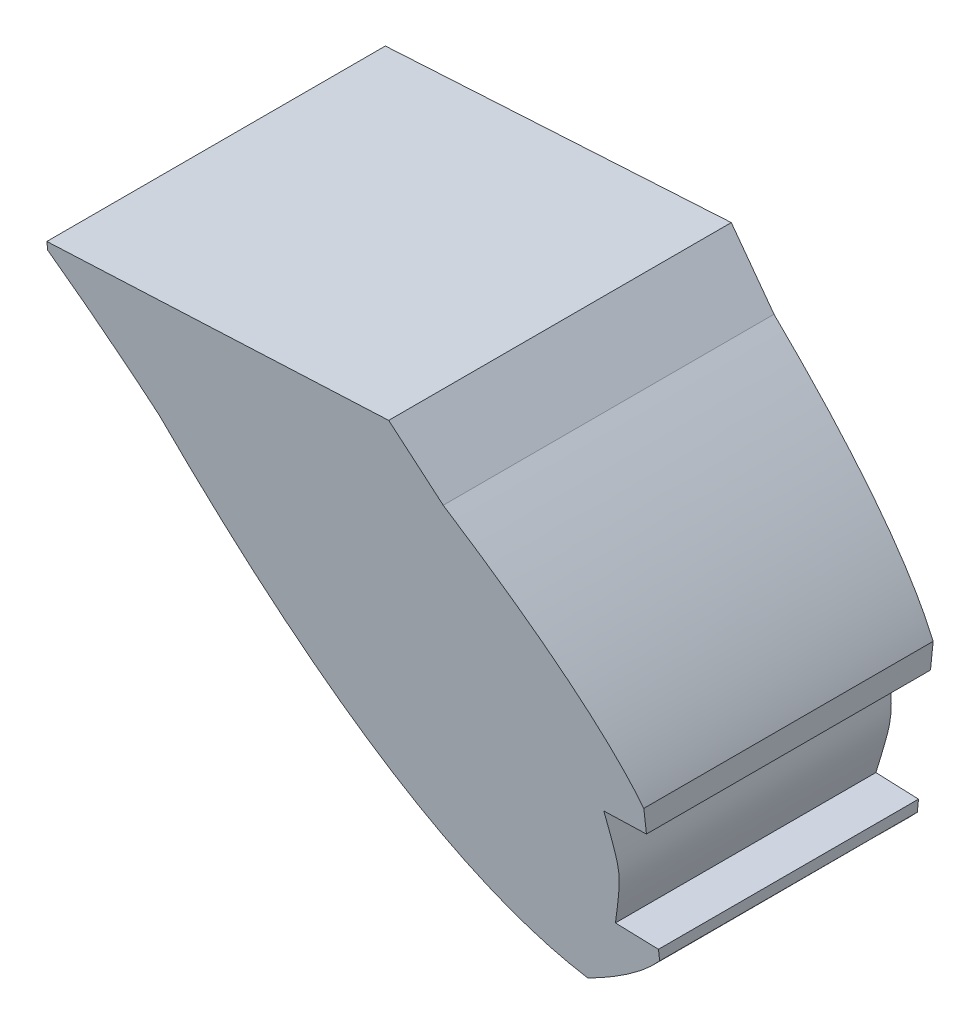
from build123d import *

# Parameters (mm, degrees)
SALIENTE_EXTRUIR1_DEPTH      = 7
SALIENTE_EXTRUIR2_DEPTH      = 7
SALIENTE_EXTRUIR2_DEPTH_BACK = 7
CORTAR_EXTRUIR2_DEPTH        = 28.177550449
CORTAR_EXTRUIR2_DEPTH_BACK   = 28.177550449


with BuildPart() as part:
    # Croquis1 → Saliente-Extruir1 (new, symmetric)
    with BuildSketch(Plane.XY):
        with BuildLine():
            add(Edge.make_bspline(
                [(-18.945192114, 7.540918896), (-10.215008384, -3.697644103), (-2.846604825, -5.059081104)],
                knots=[0.497667241, 0.497667241, 0.497667241, 0.49955428, 0.49955428, 0.49955428], degree=2, weights=[1, 1, 1]))
            add(Edge.make_bspline(
                [(-2.846604825, -5.059081104), (-0.742366882, -3.9352066), (0.355125, -2.723253227)],
                knots=[0.498812075, 0.498812075, 0.498812075, 0.499412845, 0.499412845, 0.499412845], degree=2, weights=[1, 1, 1]))
            Line((0.355125, -2.723253227), (0.355125, -2.284841781))
            Line((0.355125, -2.284841781), (-1.394875, -2.223730435))
            add(Edge.make_bspline(
                [(-1.394875, -2.223730435), (-0.90753067, -0.123730435), (-1.394875, 1.976269565)],
                knots=[0, 0, 0, 1, 1, 1], degree=2, weights=[1, 3.231801219, 1]))
            Line((-1.394875, 1.976269565), (0.355125, 2.284841781))
            Line((0.355125, 2.284841781), (0.355125, 3.001549529))
            add(Edge.make_bspline(
                [(0.355125, 3.001549529), (-1.44872627, 6.058427314), (-6.994875026, 10.477389992)],
                knots=[0.500820705, 0.500820705, 0.500820705, 0.502013312, 0.502013312, 0.502013312], degree=2, weights=[1, 1, 1]))
            Line((-6.994875026, 10.477389992), (-8.981845695, 12.608155172))
            Line((-8.981845695, 12.608155172), (-23.035921146, 11.871612288))
            Line((-23.035921146, 11.871612288), (-23.035921146, 11.54013782))
            ThreePointArc((-23.035921146, 11.54013782), (-20.949684518, 9.582335705), (-18.945192114, 7.540918896))
        make_face()
    extrude(amount=SALIENTE_EXTRUIR1_DEPTH, both=True)

    # Croquis4 → Saliente-Extruir2 (add, two sides: drawn at the far end of the back side and taken through both)
    with BuildSketch(Plane.XY.offset(-SALIENTE_EXTRUIR2_DEPTH_BACK)):
        Polygon((-1.394875, 1.976269565), (0.355125, 2.284841781), (0.355125, 2.037380912), align=None)
    extrude(amount=SALIENTE_EXTRUIR2_DEPTH + SALIENTE_EXTRUIR2_DEPTH_BACK)

    # Croquis6 → Cortar-Extruir2 (cut, two sides: drawn at the far end of the back side and taken through both)
    with BuildSketch(Plane(origin=(0, 0, 0), x_dir=(0, 0, -1), z_dir=(1, 0, 0)).offset(-CORTAR_EXTRUIR2_DEPTH_BACK)):
        Polygon((7, 12.608155172), (7, -5.059081104), (5, -5.059081104), align=None)
        Polygon((-7, 12.608155172), (-7, -5.059081104), (-5, -5.059081104), align=None)
    extrude(amount=CORTAR_EXTRUIR2_DEPTH + CORTAR_EXTRUIR2_DEPTH_BACK, mode=Mode.SUBTRACT)


solid = part.part
